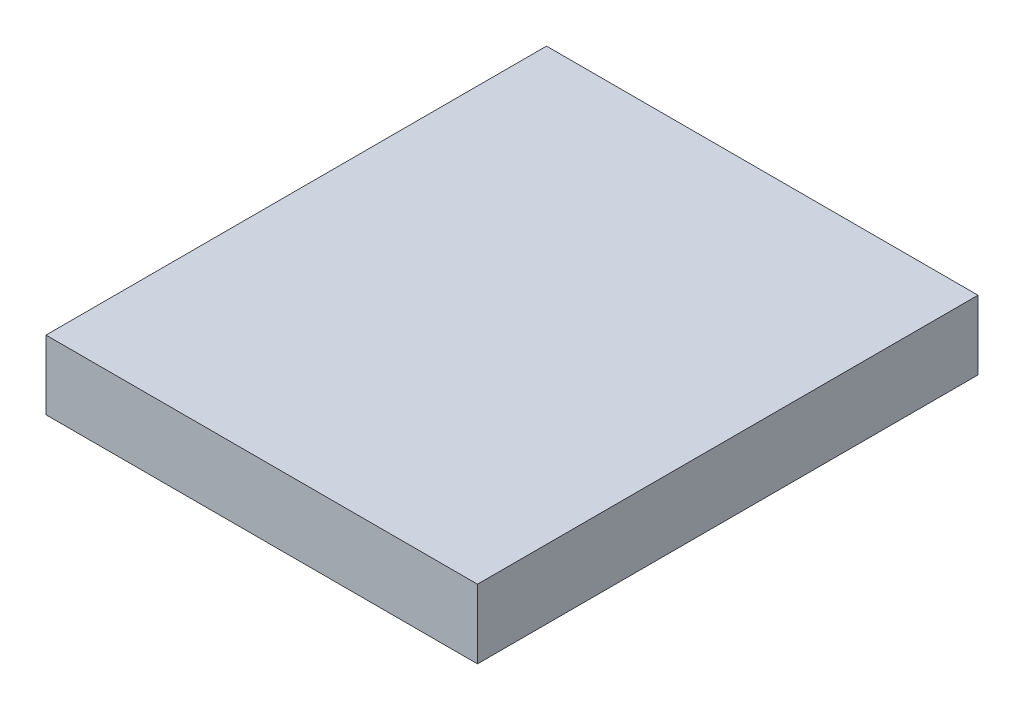
from build123d import *

# Parameters (mm, degrees)
SKETCH1_W           = 158.75
SKETCH1_H           = 184.15
BOSS_EXTRUDE1_DEPTH = 25.4
SHELL1_T            = -2.54


with BuildPart() as part:
    # Sketch1 → Boss-Extrude1 (new body)
    with BuildSketch(Plane(origin=(0, 2.54, 0), x_dir=(1, 0, 0), z_dir=(0, 1, 0))):
        Rectangle(SKETCH1_W, SKETCH1_H)
    extrude(amount=-BOSS_EXTRUDE1_DEPTH)

    # Shell1
    shell1_openings = [part.faces().sort_by_distance(p)[0] for p in [
        (0, -22.86, 0),
    ]]
    offset(amount=SHELL1_T, openings=shell1_openings, kind=Kind.INTERSECTION)


solid = part.part
